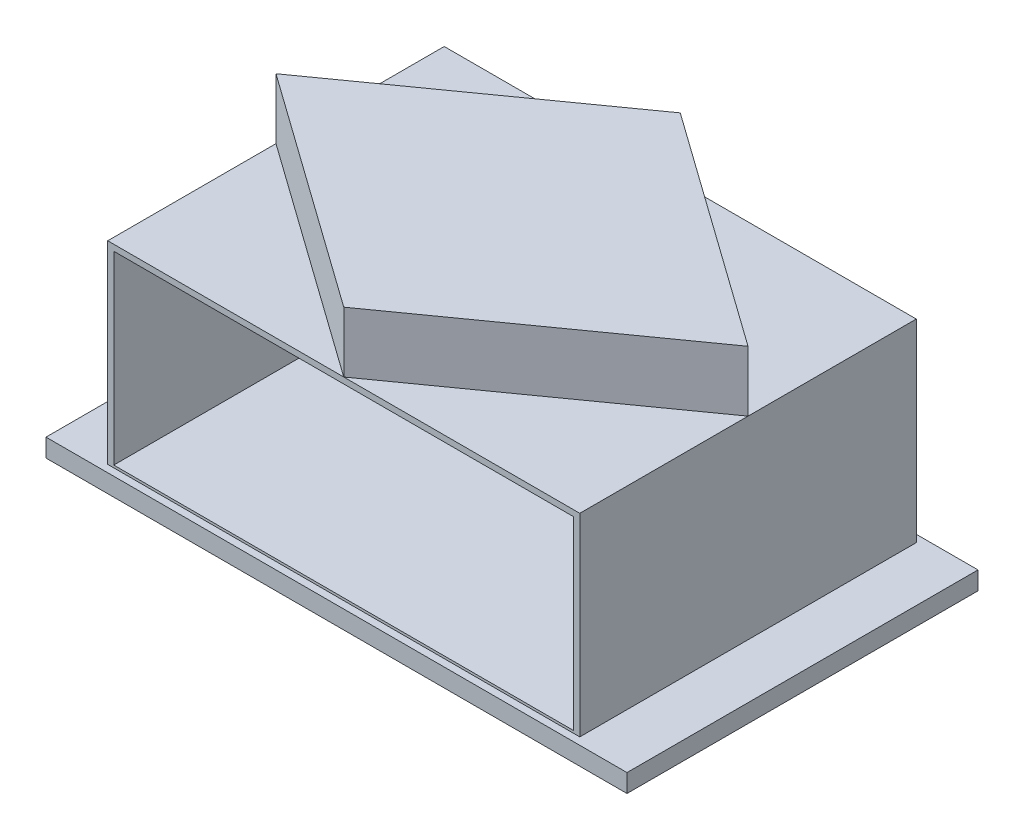
from build123d import *

# Parameters (mm, degrees)
SKETCH_1_W          = 480
SKETCH_1_H          = 290
EXTRUDE_1_DEPTH     = 15
SKETCH_2_W          = 390
SKETCH_2_H          = 178
EXTRUDE_2_DEPTH     = 160
SKETCH_7_W          = 390
SKETCH_7_H          = 160
EXTRUDE_7_DEPTH     = 100
SKETCH_8_W          = 380
SKETCH_8_H          = 153
CUT_EXTRUDE_1_DEPTH = 240
EXTRUDE_8_DEPTH     = 50


with BuildPart() as part:
    # 草图1 → 凸台-拉伸1 (new body)
    with BuildSketch(Plane(origin=(0, 0, 0), x_dir=(1, 0, 0), z_dir=(0, 1, 0))):
        Rectangle(SKETCH_1_W, SKETCH_1_H)
    extrude(amount=-EXTRUDE_1_DEPTH)

    # 草图2 → 凸台-拉伸2 (add)
    with BuildSketch(Plane(origin=(0, 0, 0), x_dir=(1, 0, 0), z_dir=(0, 1, 0))):
        with Locations((0, 50)):
            Rectangle(SKETCH_2_W, SKETCH_2_H)
    extrude(amount=EXTRUDE_2_DEPTH)

    # 草图7 → 凸台-拉伸7 (add)
    with BuildSketch(Plane.XY.offset(39)):
        with Locations((0, 80)):
            Rectangle(SKETCH_7_W, SKETCH_7_H)
    extrude(amount=EXTRUDE_7_DEPTH)

    # 草图8 → 切除-拉伸1 (cut)
    with BuildSketch(Plane.XY.offset(139)):
        with Locations((0, 78.5)):
            Rectangle(SKETCH_8_W, SKETCH_8_H)
    extrude(amount=-CUT_EXTRUDE_1_DEPTH, mode=Mode.SUBTRACT)

    # 草图10 → 凸台-拉伸8 (add)
    with BuildSketch(Plane(origin=(0, 160, 0), x_dir=(1, 0, 0), z_dir=(0, 1, 0))):
        Polygon((0, 139), (-195, 0), (0, -139), (195, 0), align=None)
    extrude(amount=EXTRUDE_8_DEPTH)


solid = part.part
